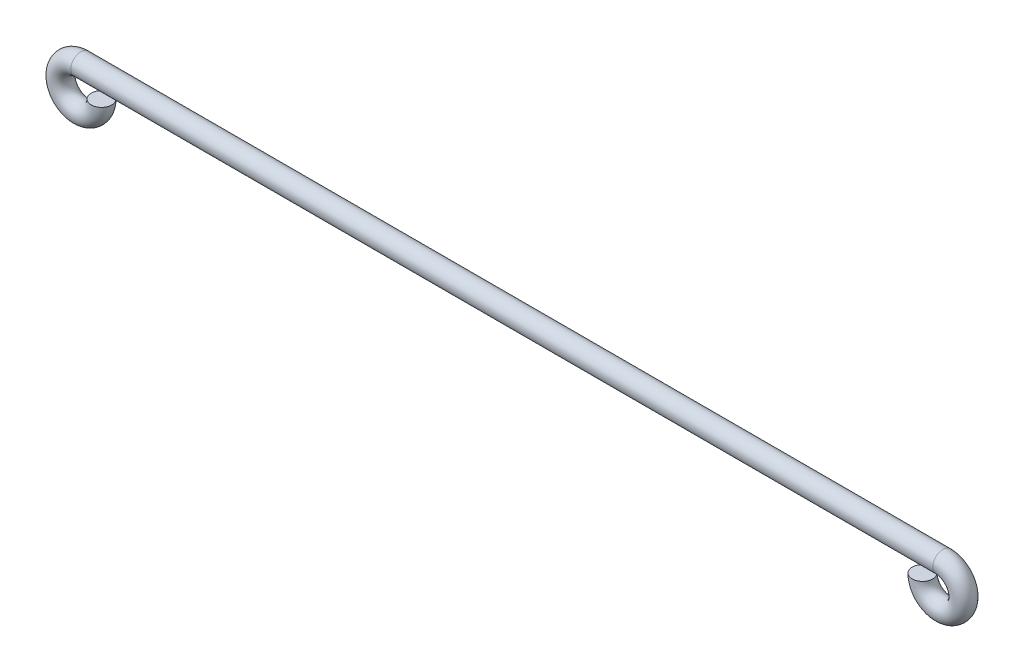
from build123d import *

# Parameters (mm, degrees)
ESQUISSE2_R = 0.5


with BuildPart() as part:
    # Balayage1: sweep along a path in Esquisse1
    with BuildLine(Plane.XY) as balayage1_path:
        ThreePointArc((0, 0), (-1.707106781, -0.707106781), (-1, 1))
        Line((-1, 1), (41, 1))
        ThreePointArc((41, 1), (41.707106781, -0.707106781), (40, 0))
    # Esquisse2 → Balayage1 (sweep)
    with BuildSketch(Plane(origin=(0, 0, 0), x_dir=(1, 0, 0), z_dir=(0, 1, 0))):
        Circle(ESQUISSE2_R)
    sweep(path=balayage1_path.line)


solid = part.part
